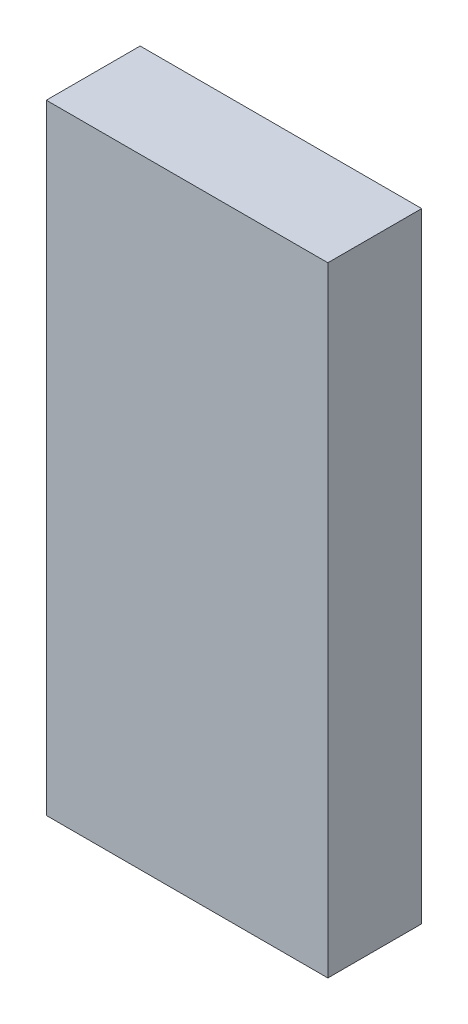
from build123d import *

# Parameters (mm, degrees)
SKETCH1_W           = 15
SKETCH1_H           = 33
BOSS_EXTRUDE1_DEPTH = 5


with BuildPart() as part:
    # Sketch1 → Boss-Extrude1 (new body)
    with BuildSketch(Plane.XY):
        with Locations((7.5, 16.5)):
            Rectangle(SKETCH1_W, SKETCH1_H)
    extrude(amount=BOSS_EXTRUDE1_DEPTH)


solid = part.part
